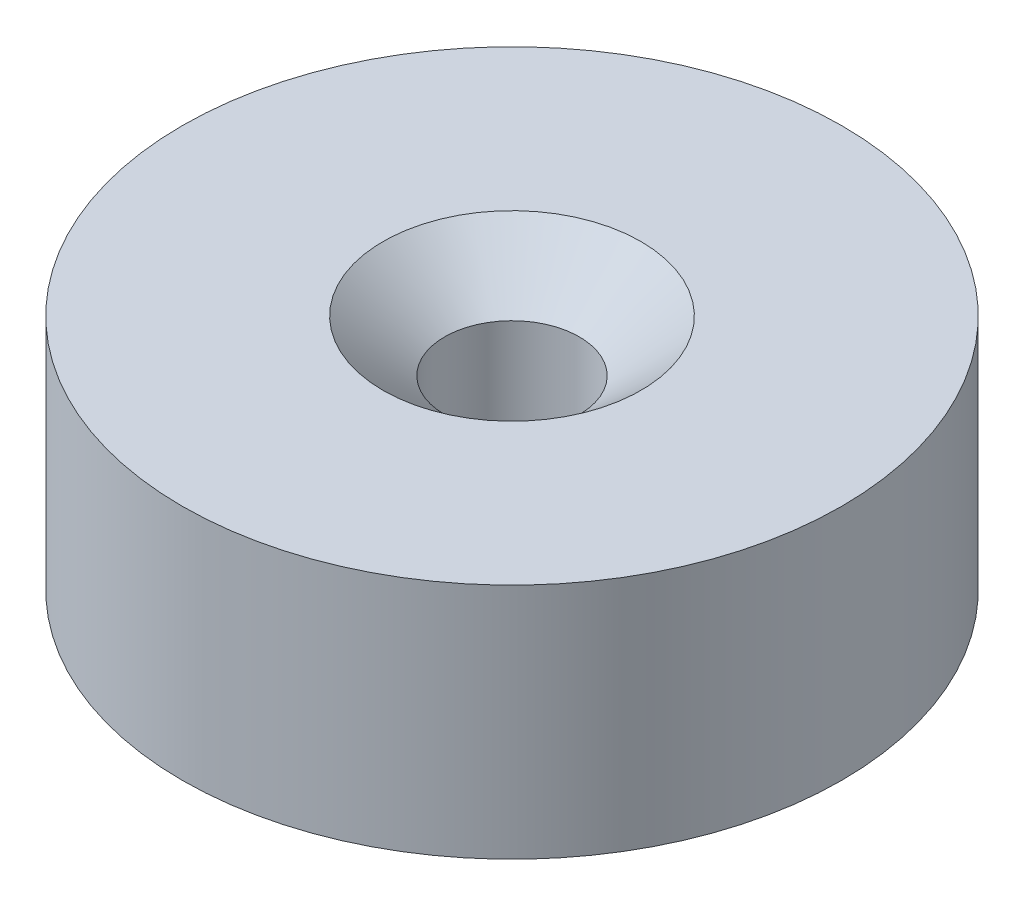
from build123d import *

# Parameters (mm, degrees)
SKETCH1_R                                          = 12.5
SKETCH1_R_2                                        = 2
BOSS_EXTRUDE1_DEPTH                                = 9
CSK_FOR_10_FLAT_HEAD_MACHINE_SCREW_100_D           = 5.1054
CSK_FOR_10_FLAT_HEAD_MACHINE_SCREW_100_CSINK_D     = 9.779
CSK_FOR_10_FLAT_HEAD_MACHINE_SCREW_100_CSINK_ANGLE = 100


with BuildPart() as part:
    # Sketch1 → Boss-Extrude1 (new body)
    with BuildSketch(Plane(origin=(0, 0, 0), x_dir=(1, 0, 0), z_dir=(0, 1, 0))):
        with Locations(Location((0, 0, 0), (0, 0, 270))):
            Circle(SKETCH1_R)
        with Locations(Location((0, 0, 0), (0, 0, 270))):
            Circle(SKETCH1_R_2, mode=Mode.SUBTRACT)
    extrude(amount=BOSS_EXTRUDE1_DEPTH)

    # CSK for #10 Flat Head Machine Screw (100)1 (through all)
    with Locations(Plane(origin=(0, 9, 0), x_dir=(1, 0, 0), z_dir=(0, 1, 0))):
        with Locations((0, 0)):
            CounterSinkHole(CSK_FOR_10_FLAT_HEAD_MACHINE_SCREW_100_D / 2, CSK_FOR_10_FLAT_HEAD_MACHINE_SCREW_100_CSINK_D / 2, counter_sink_angle=CSK_FOR_10_FLAT_HEAD_MACHINE_SCREW_100_CSINK_ANGLE)


solid = part.part
